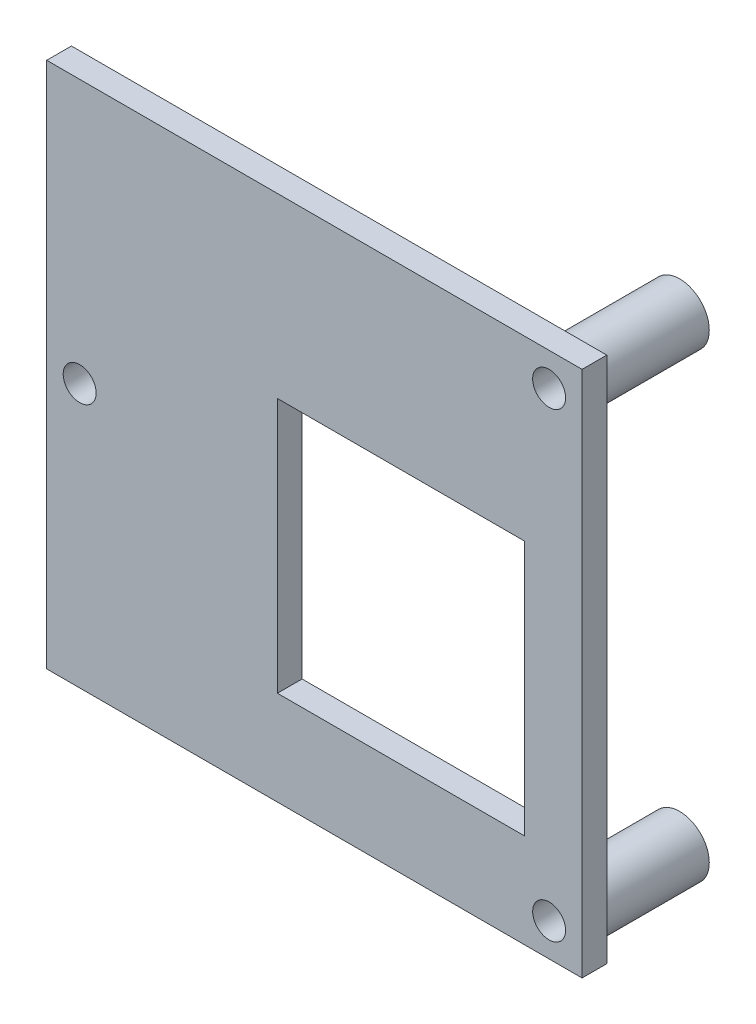
from build123d import *

# Parameters (mm, degrees)
SKETCH1_W             = 65
SKETCH1_H             = 64
BOSS_EXTRUDE1_DEPTH   = 3
F_4_0MM_DOWEL_HOLE1_D = 4
BOSS_EXTRUDE2_START   = 12.845580916
SKETCH4_R             = 3.6
SKETCH4_R_2           = 2
BOSS_EXTRUDE2_DEPTH   = 12.845580916
CUT_EXTRUDE4_REACH    = 284.08
SKETCH5_W             = 30
SKETCH5_H             = 31


with BuildPart() as part:
    # Sketch1 → Boss-Extrude1 (new body)
    with BuildSketch(Plane(origin=(0, -5.589e-05, 1278.621377902), x_dir=(1, 0, 0), z_dir=(0, -4.371138800000001e-08, 0.999999999999999))):
        with Locations((-222.546248068, 87.454866132)):
            Rectangle(SKETCH1_W, SKETCH1_H)
    extrude(amount=BOSS_EXTRUDE1_DEPTH)

    # Ø4.0mm Dowel Hole1 (through all)
    with Locations(Plane(origin=(0, -5.6021e-05, 1281.621377902), x_dir=(-1, 0, 0), z_dir=(0, -4.371138867531602e-08, 0.999999999999999))):
        with Locations((251.046248068, -87.454866132), (194.046248068, -115.454866132), (194.046248068, -59.454866132)):
            Hole(F_4_0MM_DOWEL_HOLE1_D / 2)

    # Sketch4 → Boss-Extrude2 (add)
    # profile 1 of 3: a face of its own
    with BuildSketch(Plane(origin=(0, -5.589e-05, 1278.621377902), x_dir=(-1, 0, 0), z_dir=(0, 4.371138867531603e-08, -0.9999999999999991)).offset(BOSS_EXTRUDE2_START)):
        with Locations(Location((194.046248068, 115.454866132, 0), (0, 0, 270))):
            Circle(SKETCH4_R)
        with Locations(Location((194.046248068, 115.454866132, 0), (0, 0, 270))):
            Circle(SKETCH4_R_2, mode=Mode.SUBTRACT)
    # profile 2 of 3: a face of its own
    with BuildSketch(Plane(origin=(0, -5.589e-05, 1278.621377902), x_dir=(-1, 0, 0), z_dir=(0, 4.371138867531603e-08, -0.9999999999999991)).offset(BOSS_EXTRUDE2_START)):
        with Locations(Location((251.046248068, 87.454866132, 0), (0, 0, 270))):
            Circle(SKETCH4_R)
        with Locations(Location((251.046248068, 87.454866132, 0), (0, 0, 270))):
            Circle(SKETCH4_R_2, mode=Mode.SUBTRACT)
    # profile 3 of 3: a face of its own
    with BuildSketch(Plane(origin=(0, -5.589e-05, 1278.621377902), x_dir=(-1, 0, 0), z_dir=(0, 4.371138867531603e-08, -0.9999999999999991)).offset(BOSS_EXTRUDE2_START)):
        with Locations(Location((194.046248068, 59.454866132, 0), (0, 0, 270))):
            Circle(SKETCH4_R)
        with Locations(Location((194.046248068, 59.454866132, 0), (0, 0, 270))):
            Circle(SKETCH4_R_2, mode=Mode.SUBTRACT)
    extrude(amount=-BOSS_EXTRUDE2_DEPTH)

    # Sketch5 → Cut-Extrude4 (cut, up to next)
    with BuildSketch(Plane(origin=(0, -5.6021e-05, 1281.621377902), x_dir=(1, 0, 0), z_dir=(0, -4.371138867531602e-08, 0.999999999999999)), mode=Mode.PRIVATE) as cut_extrude4_sk1:
        with Locations((-212.038243782, 82.401305574)):
            Rectangle(SKETCH5_W, SKETCH5_H)
    cut_extrude4_tool1 = extrude(cut_extrude4_sk1.sketch, amount=-CUT_EXTRUDE4_REACH, mode=Mode.PRIVATE) & part.part
    add(cut_extrude4_tool1.solids().sort_by_distance((-212.038244, 82.40125, 1281.621382))[0], mode=Mode.SUBTRACT)


solid = part.part
